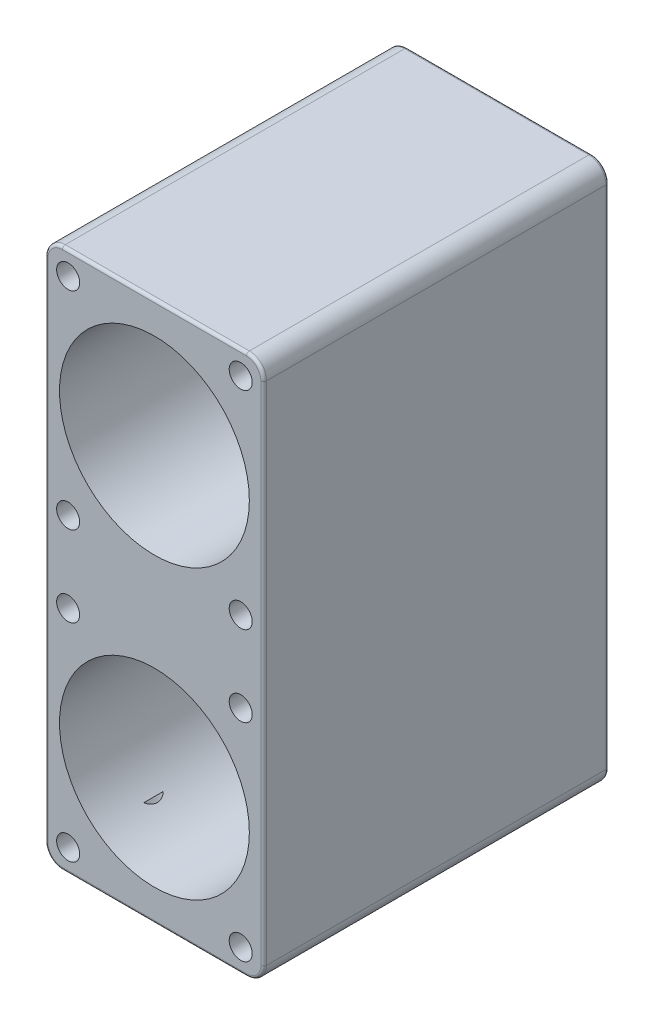
from build123d import *

# Parameters (mm, degrees)
SKETCH1_R           = 419.1
BOSS_EXTRUDE1_DEPTH = 762
SKETCH2_R           = 50.8
CUT_EXTRUDE1_DEPTH  = 254
SKETCH3_R           = 50.8
CUT_EXTRUDE2_DEPTH  = 177.8
SKETCH4_R           = 50.8
CUT_EXTRUDE3_DEPTH  = 1996.153427684
FILLET1_R           = 12.7
SKETCH5_R           = 63.5
CUT_EXTRUDE4_DEPTH  = 228.6
SKETCH7_R           = 50.8
CUT_EXTRUDE5_DEPTH  = 254


with BuildPart() as part:
    # Sketch1 → Boss-Extrude1 (new, symmetric)
    with BuildSketch(Plane.XY):
        with BuildLine():
            Line((-406.4, 1193.8), (406.4, 1193.8))
            ThreePointArc((406.4, 1193.8), (460.281536726, 1171.481536726), (482.6, 1117.6))
            Line((482.6, 1117.6), (482.6, -1117.6))
            ThreePointArc((482.6, -1117.6), (460.281536726, -1171.481536726), (406.4, -1193.8))
            Line((406.4, -1193.8), (-406.4, -1193.8))
            ThreePointArc((-406.4, -1193.8), (-460.281536726, -1171.481536726), (-482.6, -1117.6))
            Line((-482.6, -1117.6), (-482.6, 1117.6))
            ThreePointArc((-482.6, 1117.6), (-460.281536726, 1171.481536726), (-406.4, 1193.8))
        make_face()
        with Locations((0, 635)):
            Circle(SKETCH1_R, mode=Mode.SUBTRACT)
        with Locations((0, -635)):
            Circle(SKETCH1_R, mode=Mode.SUBTRACT)
    extrude(amount=BOSS_EXTRUDE1_DEPTH, both=True)

    # Sketch2 → Cut-Extrude1 (cut)
    with BuildSketch(Plane.XY.offset(762)):
        with Locations((-381, 177.8)):
            Circle(SKETCH2_R)
        with Locations((-381, -177.8)):
            Circle(SKETCH2_R)
        with Locations((381, 177.8)):
            Circle(SKETCH2_R)
        with Locations((381, -177.8)):
            Circle(SKETCH2_R)
    extrude(amount=-CUT_EXTRUDE1_DEPTH, mode=Mode.SUBTRACT)

    # Sketch3 → Cut-Extrude2 (cut)
    with BuildSketch(Plane.XY.offset(762)):
        with Locations((-381, -1092.2)):
            Circle(SKETCH3_R)
        with Locations((381, -1092.2)):
            Circle(SKETCH3_R)
    extrude(amount=-CUT_EXTRUDE2_DEPTH, mode=Mode.SUBTRACT)

    # Sketch4 → Cut-Extrude3 (cut, through all)
    with BuildSketch(Plane.XY.offset(762)):
        with Locations((-381, 1092.2)):
            Circle(SKETCH4_R)
        with Locations((381, 1092.2)):
            Circle(SKETCH4_R)
    extrude(amount=-CUT_EXTRUDE3_DEPTH, mode=Mode.SUBTRACT)

    # Fillet1
    fillet1_edges = [part.edges().sort_by_distance(p)[0] for p in [
        (0, 1193.8, -762),
        (460.281536726, 1171.481536726, -762),
        (482.6, 0, -762),
        (460.281536726, -1171.481536726, -762),
        (460.281536726, 1171.481536726, 762),
        (0, 1193.8, 762),
        (-460.281536726, 1171.481536726, 762),
        (-482.6, 0, 762),
        (-460.281536726, -1171.481536726, 762),
        (0, -1193.8, 762),
        (460.281536726, -1171.481536726, 762),
        (0, -1193.8, -762),
        (482.6, 0, 762),
        (-460.281536726, -1171.481536726, -762),
        (-482.6, 0, -762),
        (-460.281536726, 1171.481536726, -762),
    ]]
    fillet(fillet1_edges, radius=FILLET1_R)

    # Sketch5 → Cut-Extrude4 (cut)
    with BuildSketch(Plane.XZ.offset(1193.8)):
        with Locations(Location((-304.8, 508, 0), (0, 0, 270))):
            Circle(SKETCH5_R)
        with Locations(Location((304.8, 508, 0), (0, 0, 270))):
            Circle(SKETCH5_R)
        with Locations(Location((-304.8, -508, 0), (0, 0, 270))):
            Circle(SKETCH5_R)
        with Locations(Location((304.8, -508, 0), (0, 0, 270))):
            Circle(SKETCH5_R)
    extrude(amount=-CUT_EXTRUDE4_DEPTH, mode=Mode.SUBTRACT)

    # Sketch7 → Cut-Extrude5 (cut)
    with BuildSketch(Plane(origin=(0, 0, -762), x_dir=(-1, 0, 0), z_dir=(0, 0, -1))):
        with Locations((-355.6, 152.4)):
            Circle(SKETCH7_R)
        with Locations((-355.6, -152.4)):
            Circle(SKETCH7_R)
        with Locations((355.6, 152.4)):
            Circle(SKETCH7_R)
        with Locations((355.6, -152.4)):
            Circle(SKETCH7_R)
    extrude(amount=-CUT_EXTRUDE5_DEPTH, mode=Mode.SUBTRACT)


solid = part.part
